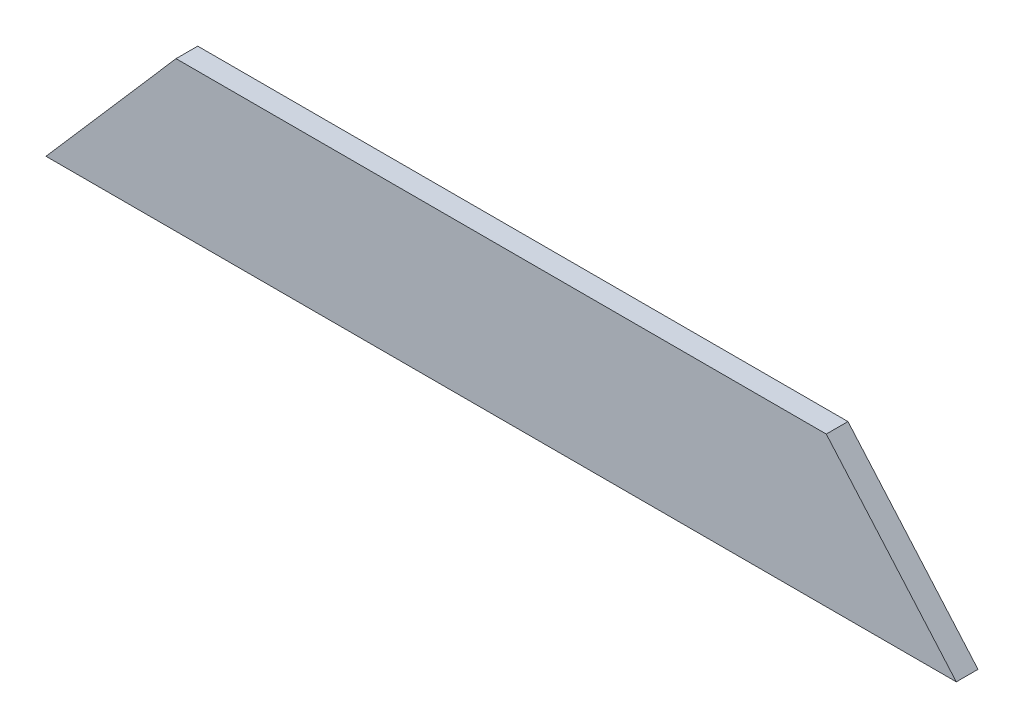
from build123d import *

# Parameters (mm, degrees)
Y_KSEKLIK_EKSTR_ZYON1_DEPTH = 2


with BuildPart() as part:
    # Çizim2 → Yükseklik-Ekstrüzyon1 (new body)
    with BuildSketch(Plane.XY):
        Polygon((0, 0), (84, 0), (72, 13.804420887), (12, 13.804420887), align=None)
    extrude(amount=Y_KSEKLIK_EKSTR_ZYON1_DEPTH)


solid = part.part
